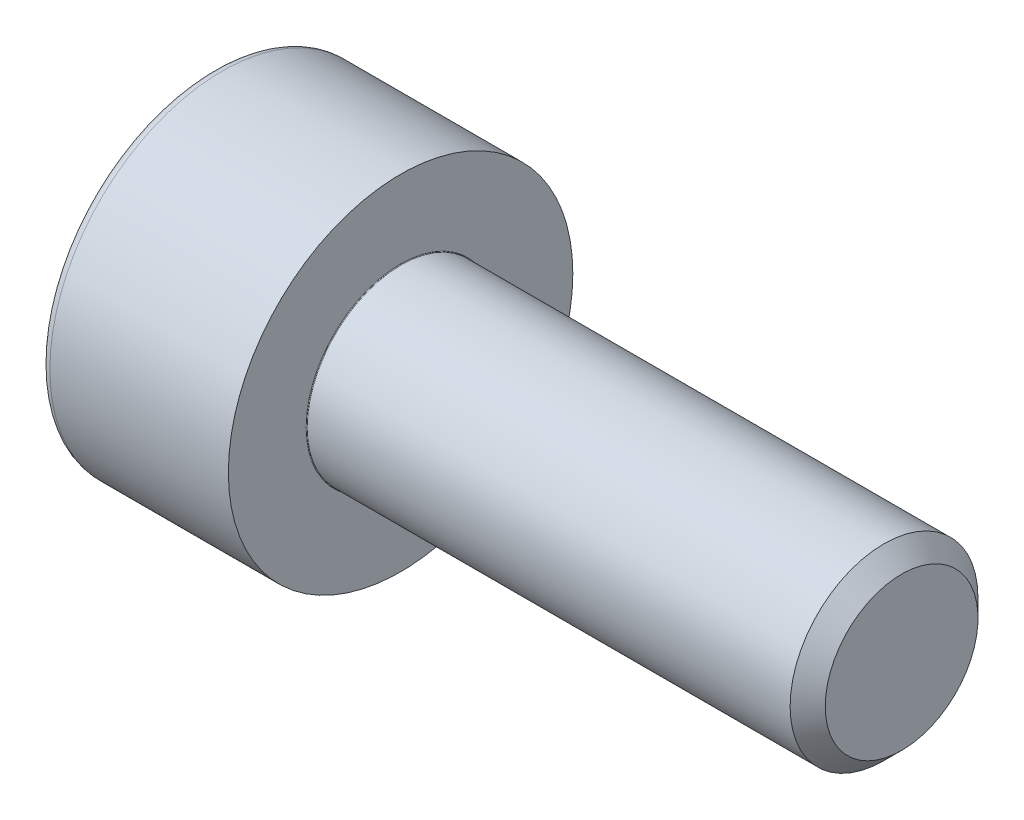
from build123d import *

# Parameters (mm, degrees)
FILLET1_R   = 0.01
FILLET2_R   = 0.15
HEX_2_DEPTH = 1.3


with BuildPart() as part:
    # BodySke → Base-Revolve (revolve)
    with BuildSketch(Plane.XY, mode=Mode.PRIVATE) as base_revolve_sk:
        Polygon((0, 0), (0, 2.75), (3, 2.75), (3, 1.5), (10.7195, 1.5), (11, 1.2195), (11, 0), align=None)
    revolve(base_revolve_sk.sketch.rotate(Axis((-31.75, 0, 0), (1, 0, 0)), 90), axis=Axis((-31.75, 0, 0), (1, 0, 0)))

    # Fillet1
    fillet1_edges = [part.edges().sort_by_distance(p)[0] for p in [
        (3, 0, -1.5),
    ]]
    fillet(fillet1_edges, radius=FILLET1_R)

    # Fillet2
    fillet2_edges = [part.edges().sort_by_distance(p)[0] for p in [
        (0, 0, -2.75),
    ]]
    fillet(fillet2_edges, radius=FILLET2_R)

    # Sketch2 → Hex-PreBroach (revolve, cut)
    with BuildSketch(Plane.XY, mode=Mode.PRIVATE) as hex_prebroach_sk:
        Polygon((0, 1.28), (1.3, 1.28), (2.039008345, 0), (0, 0), align=None)
    revolve(hex_prebroach_sk.sketch.rotate(Axis((0, 0, 0), (1, 0, 0)), 90), axis=Axis((0, 0, 0), (1, 0, 0)), mode=Mode.SUBTRACT)

    # Sketch3 → Hex 2 (cut)
    with BuildSketch(Plane(origin=(0, 0, 0), x_dir=(0, 0.500000000000001, 0.866025403784438), z_dir=(-1, 0, 0))):
        Polygon((0.739008345, 1.28), (-0.739008345, 1.28), (-1.478016689, 0), (-0.739008345, -1.28), (0.739008345, -1.28), (1.478016689, 0), align=None)
    extrude(amount=-HEX_2_DEPTH, mode=Mode.SUBTRACT)


solid = part.part
